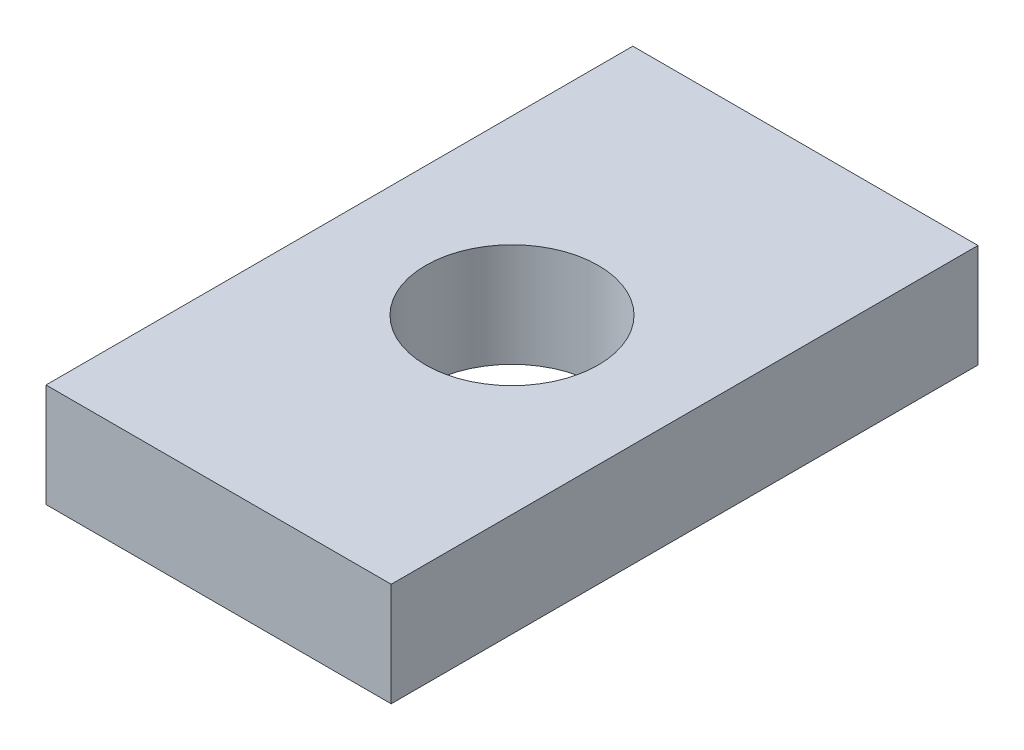
from build123d import *

# Parameters (mm, degrees)
SKETCH1_W           = 20
SKETCH1_H           = 34
SKETCH1_R           = 5
BOSS_EXTRUDE1_DEPTH = 6


with BuildPart() as part:
    # Sketch1 → Boss-Extrude1 (new body)
    with BuildSketch(Plane(origin=(0, 0, 0), x_dir=(1, 0, 0), z_dir=(0, 1, 0))):
        Rectangle(SKETCH1_W, SKETCH1_H)
        with Locations(Location((0, 0, 0), (0, 0, 270))):
            Circle(SKETCH1_R, mode=Mode.SUBTRACT)
    extrude(amount=BOSS_EXTRUDE1_DEPTH)


solid = part.part
